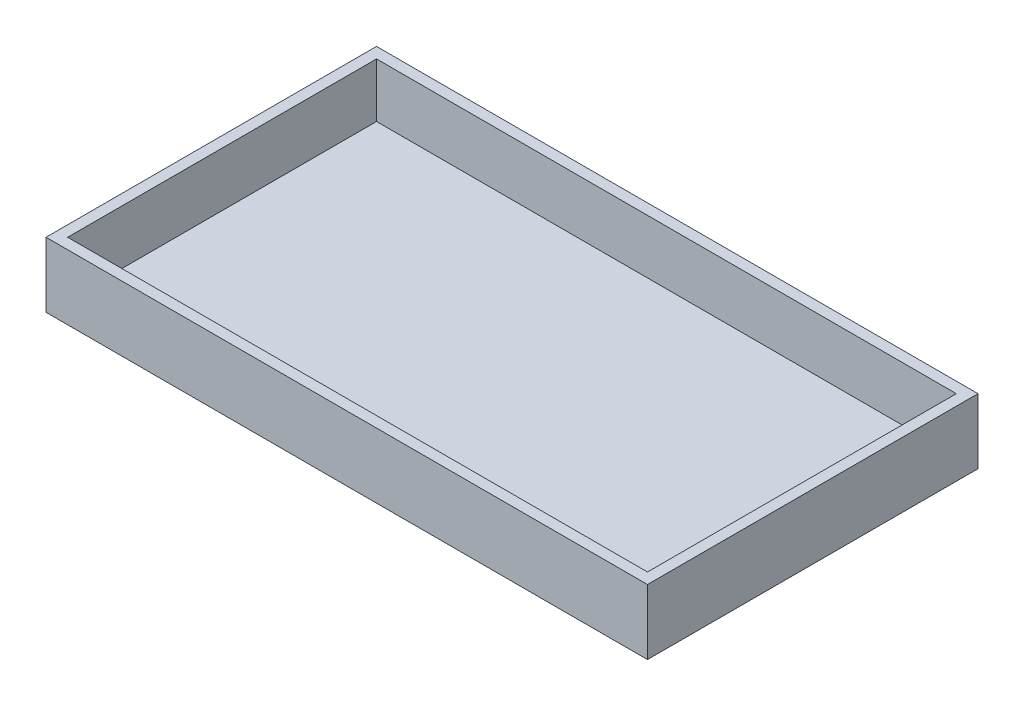
from build123d import *

# Parameters (mm, degrees)
SKETCH_1_W        = 111
SKETCH_1_H        = 61
SKETCH_1_W_2      = 107
SKETCH_1_H_2      = 57
EXTRUDE_1_DEPTH   = 10
SKETCH_3_W        = 111
SKETCH_3_H        = 61
EXTRUDE_1_2_DEPTH = 2


with BuildPart() as part:
    # 草圖1 → Extrude 1 (new body)
    with BuildSketch(Plane(origin=(0, 0, 0), x_dir=(1, 0, 0), z_dir=(0, 1, 0))):
        with Locations((53.5, 28.5)):
            Rectangle(SKETCH_1_W, SKETCH_1_H)
        with Locations((53.5, 28.5)):
            Rectangle(SKETCH_1_W_2, SKETCH_1_H_2, mode=Mode.SUBTRACT)
    extrude(amount=-EXTRUDE_1_DEPTH)

    # 草圖3 → Extrude 1 2 (add)
    with BuildSketch(Plane(origin=(0, -10, 0), x_dir=(-1, 0, 0), z_dir=(0, -1, 0))):
        with Locations((-53.5, 28.5)):
            Rectangle(SKETCH_3_W, SKETCH_3_H)
    extrude(amount=EXTRUDE_1_2_DEPTH)


solid = part.part
